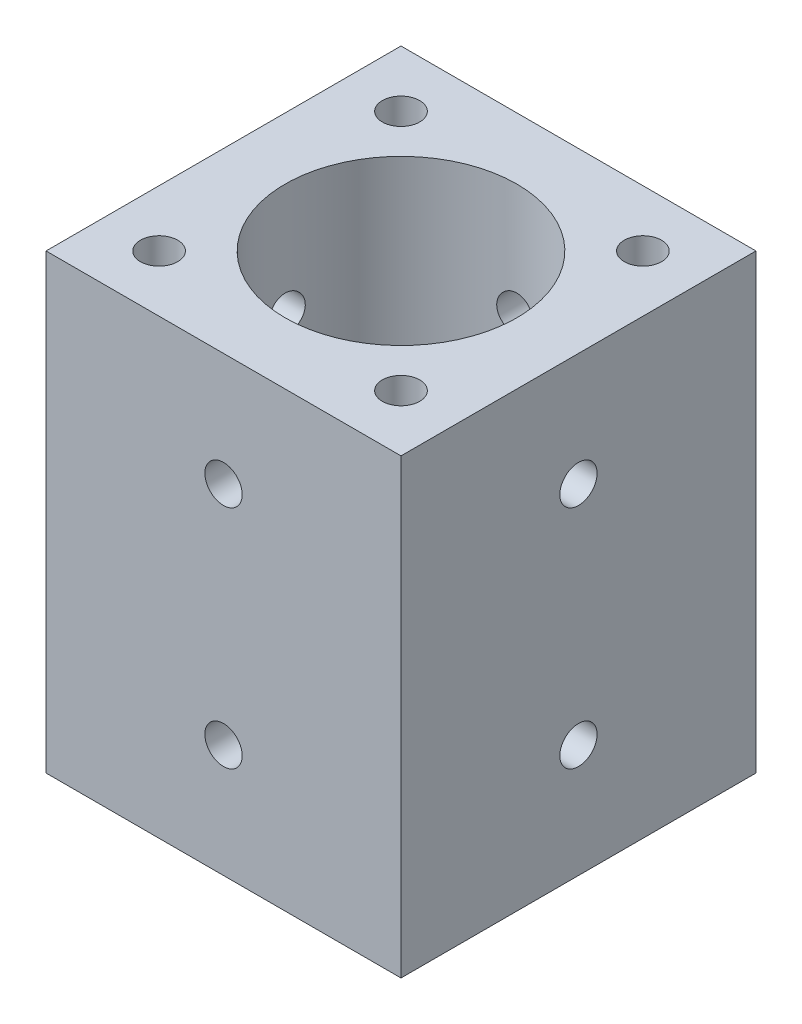
from build123d import *

# Parameters (mm, degrees)
SKETCH1_W                       = 31.4
SKETCH1_H                       = 31.4
SKETCH1_R                       = 10.25
BOSS_EXTRUDE1_DEPTH             = 40
SKETCH2_R                       = 1.5
CUT_EXTRUDE1_DEPTH              = 40
M4_TAPPED_HOLE1_D               = 3.3
M4_TAPPED_HOLE1_DEPTH           = 10.1
M4_TAPPED_HOLE1_TIP             = 0.991420021
M4_TAPPED_HOLE1_ON_FACE_2_D     = 3.3
M4_TAPPED_HOLE1_ON_FACE_2_DEPTH = 10.1
M4_TAPPED_HOLE1_ON_FACE_2_TIP   = 0.991420021
SKETCH5_R                       = 1.5
CUT_EXTRUDE2_DEPTH              = 40
M4_TAPPED_HOLE2_D               = 3.3
M4_TAPPED_HOLE2_DEPTH           = 10.1
M4_TAPPED_HOLE2_TIP             = 0.991420021
M4_TAPPED_HOLE2_ON_FACE_2_D     = 3.3
M4_TAPPED_HOLE2_ON_FACE_2_DEPTH = 10.1
M4_TAPPED_HOLE2_ON_FACE_2_TIP   = 0.991420021
SKETCH8_R                       = 1.5
CUT_EXTRUDE3_DEPTH              = 30
M4_TAPPED_HOLE3_D               = 3.3
M4_TAPPED_HOLE3_DEPTH           = 52.1
M4_TAPPED_HOLE3_TIP             = 0.991420021


with BuildPart() as part:
    # Sketch1 → Boss-Extrude1 (new body)
    with BuildSketch(Plane(origin=(0, 0, 0), x_dir=(1, 0, 0), z_dir=(0, 1, 0))):
        Rectangle(SKETCH1_W, SKETCH1_H)
        with Locations(Location((0, 0, 0), (0, 0, 270))):
            Circle(SKETCH1_R, mode=Mode.SUBTRACT)
    extrude(amount=BOSS_EXTRUDE1_DEPTH)

    # Sketch2 → Cut-Extrude1 (cut)
    with BuildSketch(Plane(origin=(15.7, 0, 0), x_dir=(0, 0, -1), z_dir=(1, 0, 0))):
        with Locations((0, 30)):
            Circle(SKETCH2_R)
        with Locations((0, 10)):
            Circle(SKETCH2_R)
    extrude(amount=-CUT_EXTRUDE1_DEPTH, mode=Mode.SUBTRACT)

    # M4 Tapped Hole1
    with Locations(Plane(origin=(-15.7, 10, 0), x_dir=(0, 0, -1), z_dir=(-1, 0, 0))):
        with Locations((0, 0), (0, -20)):
            Hole(M4_TAPPED_HOLE1_D / 2, depth=M4_TAPPED_HOLE1_DEPTH)
            with Locations((0, 0, -(M4_TAPPED_HOLE1_DEPTH + M4_TAPPED_HOLE1_TIP / 2))):  # 118° drill point
                Cone(0, M4_TAPPED_HOLE1_D / 2, M4_TAPPED_HOLE1_TIP, mode=Mode.SUBTRACT)

    # M4 Tapped Hole1 on face 2
    with Locations(Plane(origin=(15.7, 30, 0), x_dir=(0, 0, -1), z_dir=(-1, 0, 0))):
        with Locations((0, 0), (0, 20)):
            Hole(M4_TAPPED_HOLE1_ON_FACE_2_D / 2, depth=M4_TAPPED_HOLE1_ON_FACE_2_DEPTH)
            with Locations((0, 0, -(M4_TAPPED_HOLE1_ON_FACE_2_DEPTH + M4_TAPPED_HOLE1_ON_FACE_2_TIP / 2))):  # 118° drill point
                Cone(0, M4_TAPPED_HOLE1_ON_FACE_2_D / 2, M4_TAPPED_HOLE1_ON_FACE_2_TIP, mode=Mode.SUBTRACT)

    # Sketch5 → Cut-Extrude2 (cut)
    with BuildSketch(Plane.XY.offset(15.7)):
        with Locations((0, 30)):
            Circle(SKETCH5_R)
        with Locations((0, 10)):
            Circle(SKETCH5_R)
    extrude(amount=-CUT_EXTRUDE2_DEPTH, mode=Mode.SUBTRACT)

    # M4 Tapped Hole2
    with Locations(Plane(origin=(0, 30, 15.7), x_dir=(1, 0, 0), z_dir=(0, 0, 1))):
        with Locations((0, 0), (0, -20)):
            Hole(M4_TAPPED_HOLE2_D / 2, depth=M4_TAPPED_HOLE2_DEPTH)
            with Locations((0, 0, -(M4_TAPPED_HOLE2_DEPTH + M4_TAPPED_HOLE2_TIP / 2))):  # 118° drill point
                Cone(0, M4_TAPPED_HOLE2_D / 2, M4_TAPPED_HOLE2_TIP, mode=Mode.SUBTRACT)

    # M4 Tapped Hole2 on face 2
    with Locations(Plane(origin=(0, 30, -15.7), x_dir=(1, 0, 0), z_dir=(0, 0, 1))):
        with Locations((0, 0), (0, -20)):
            Hole(M4_TAPPED_HOLE2_ON_FACE_2_D / 2, depth=M4_TAPPED_HOLE2_ON_FACE_2_DEPTH)
            with Locations((0, 0, -(M4_TAPPED_HOLE2_ON_FACE_2_DEPTH + M4_TAPPED_HOLE2_ON_FACE_2_TIP / 2))):  # 118° drill point
                Cone(0, M4_TAPPED_HOLE2_ON_FACE_2_D / 2, M4_TAPPED_HOLE2_ON_FACE_2_TIP, mode=Mode.SUBTRACT)

    # Sketch8 → Cut-Extrude3 (cut)
    with BuildSketch(Plane.XZ):
        with Locations(Location((-10.7, 10.7, 0), (0, 0, 270))):
            Circle(SKETCH8_R)
        with Locations(Location((10.7, 10.7, 0), (0, 0, 90))):
            Circle(SKETCH8_R)
        with Locations(Location((10.7, -10.7, 0), (0, 0, 270))):
            Circle(SKETCH8_R)
        with Locations(Location((-10.7, -10.7, 0), (0, 0, 90))):
            Circle(SKETCH8_R)
    extrude(amount=-CUT_EXTRUDE3_DEPTH, mode=Mode.SUBTRACT)

    # M4 Tapped Hole3
    with Locations(Plane(origin=(-10.7, 0, 10.7), x_dir=(0, 0, -1), z_dir=(0, -1, 0))):
        with Locations((0, 0), (0, 21.4), (21.4, 21.4), (21.4, 0)):
            Hole(M4_TAPPED_HOLE3_D / 2, depth=M4_TAPPED_HOLE3_DEPTH)
            with Locations((0, 0, -(M4_TAPPED_HOLE3_DEPTH + M4_TAPPED_HOLE3_TIP / 2))):  # 118° drill point
                Cone(0, M4_TAPPED_HOLE3_D / 2, M4_TAPPED_HOLE3_TIP, mode=Mode.SUBTRACT)


solid = part.part
